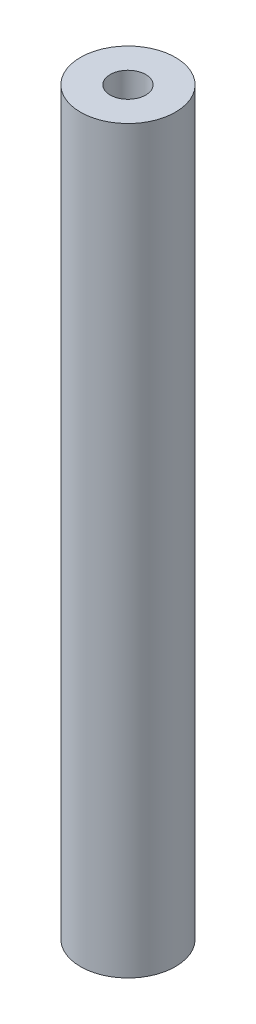
from build123d import *

# Parameters (mm, degrees)
TUBO_START  = -46.75
SK_TUBO_R   = 6
SK_TUBO_R_2 = 2.25
TUBO_DEPTH  = 93.5


with BuildPart() as part:
    # Sk_Tubo → Tubo (new body)
    with BuildSketch(Plane(origin=(0, 0, 0), x_dir=(1, 0, 0), z_dir=(0, 1, 0)).offset(TUBO_START)):
        with Locations(Location((0, -250, 0), (0, 0, 270))):
            Circle(SK_TUBO_R)
        with Locations(Location((0, -250, 0), (0, 0, 270))):
            Circle(SK_TUBO_R_2, mode=Mode.SUBTRACT)
    extrude(amount=TUBO_DEPTH)


solid = part.part
